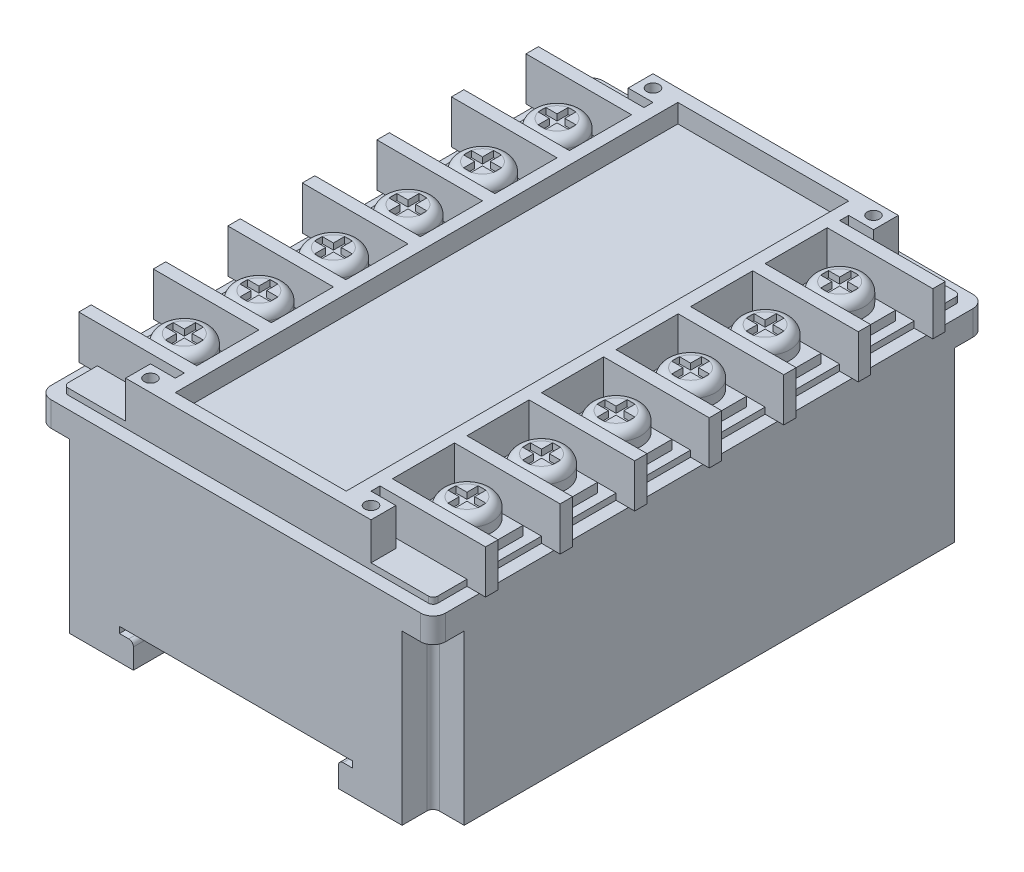
from build123d import *

# Parameters (mm, degrees)
BOSS_EXTRUDE1_DEPTH  = 44.45
SKETCH3_W            = 5
SKETCH3_H            = 5
CUT_EXTRUDE1_DEPTH   = 27.1
FILLET1_R            = 1
FILLET2_R            = 2
SKETCH4_W            = 69.628176227
SKETCH4_H            = 95.221235597
CUT_EXTRUDE2_DEPTH   = 1
SKETCH5_R            = 1
BOSS_EXTRUDE2_DEPTH  = 6
BOSS_EXTRUDE3_START  = -1
SKETCH7_W            = 17
SKETCH7_H            = 2
BOSS_EXTRUDE3_DEPTH  = 7
SKETCH8_W            = 27.5
SKETCH8_H            = 80.9
CUT_EXTRUDE3_DEPTH   = 3
SKETCH9_W            = 11
SKETCH9_H            = 7
BOSS_EXTRUDE4_DEPTH  = 1.5
CUT_EXTRUDE4_DEPTH   = 1
LPATTERN1_COUNT      = 6
LPATTERN1_PITCH      = 12
LPATTERN1_COUNT_DIR2 = 2
LPATTERN1_PITCH_DIR2 = 45.5


with BuildPart() as part:
    # Sketch2 → Boss-Extrude1 (new, symmetric)
    with BuildSketch(Plane.XY):
        with BuildLine():
            Line((0, 0), (1.5, 0))
            ThreePointArc((1.5, 0), (2.030330086, -0.219669914), (2.25, -0.75))
            Line((2.25, -0.75), (2.25, -4))
            Line((2.25, -4), (-13, -4))
            Line((-13, -4), (-13, 28.1))
            Line((-13, 28.1), (50.5, 28.1))
            Line((50.5, 28.1), (50.5, -4))
            Line((50.5, -4), (35.25, -4))
            Line((35.25, -4), (35.25, -0.75))
            ThreePointArc((35.25, -0.75), (35.469669914, -0.219669914), (36, 0))
            Line((36, 0), (37.5, 0))
            Line((37.5, 0), (37.5, 1))
            Line((37.5, 1), (0, 1))
            Line((0, 1), (0, 0))
        make_face()
    extrude(amount=BOSS_EXTRUDE1_DEPTH, both=True)

    # Sketch3 → Cut-Extrude1 (cut)
    with BuildSketch(Plane.XZ.offset(4)):
        with Locations((-10.5, 41.95)):
            Rectangle(SKETCH3_W, SKETCH3_H)
        with Locations((48, 41.95)):
            Rectangle(SKETCH3_W, SKETCH3_H)
        with Locations((-10.5, -41.95)):
            Rectangle(SKETCH3_W, SKETCH3_H)
        with Locations((48, -41.95)):
            Rectangle(SKETCH3_W, SKETCH3_H)
    extrude(amount=-CUT_EXTRUDE1_DEPTH, mode=Mode.SUBTRACT)

    # Fillet1
    fillet1_edges = [part.edges().sort_by_distance(p)[0] for p in [
        (-8, 9.55, 39.45),
        (45.5, 9.55, 39.45),
        (-8, 9.55, -39.45),
        (45.5, 9.55, -39.45),
    ]]
    fillet(fillet1_edges, radius=FILLET1_R)

    # Fillet2
    fillet2_edges = [part.edges().sort_by_distance(p)[0] for p in [
        (-13, 25.6, -44.45),
        (-13, 25.6, 44.45),
        (50.5, 25.6, 44.45),
        (50.5, 25.6, -44.45),
    ]]
    fillet(fillet2_edges, radius=FILLET2_R)

    # Sketch4 → Cut-Extrude2 (cut)
    with BuildSketch(Plane(origin=(0, 28.1, 0), x_dir=(1, 0, 0), z_dir=(0, 1, 0))):
        with Locations((18.746661878, -0.256955383)):
            Rectangle(SKETCH4_W, SKETCH4_H)
        with BuildLine():
            Line((-10.25, -42.45), (47.75, -42.45))
            ThreePointArc((47.75, -42.45), (48.280330086, -42.230330086), (48.5, -41.7))
            Line((48.5, -41.7), (48.5, 41.7))
            ThreePointArc((48.5, 41.7), (48.280330086, 42.230330086), (47.75, 42.45))
            Line((47.75, 42.45), (-10.25, 42.45))
            ThreePointArc((-10.25, 42.45), (-10.780330086, 42.230330086), (-11, 41.7))
            Line((-11, 41.7), (-11, -41.7))
            ThreePointArc((-11, -41.7), (-10.780330086, -42.230330086), (-10.25, -42.45))
        make_face(mode=Mode.SUBTRACT)
    extrude(amount=-CUT_EXTRUDE2_DEPTH, mode=Mode.SUBTRACT)

    # Sketch5 → Boss-Extrude2 (add)
    with BuildSketch(Plane(origin=(0, 28.1, 0), x_dir=(1, 0, 0), z_dir=(0, 1, 0))):
        Polygon((3, 42.45), (34.5, 42.45), (38.5, 42.45), (38.5, 38.45), (34.5, 38.45), (34.5, -38.45), (38.5, -38.45), (38.5, -42.45), (34.5, -42.45), (3, -42.45), (-1, -42.45), (-1, -38.45), (3, -38.45), (3, 38.45), (-1, 38.45), (-1, 42.45), align=None)
        with Locations(Location((1, 40.45, 0), (0, 0, 270))):
            Circle(SKETCH5_R, mode=Mode.SUBTRACT)
        with Locations(Location((36.5, 40.45, 0), (0, 0, 270))):
            Circle(SKETCH5_R, mode=Mode.SUBTRACT)
        with Locations(Location((36.5, -40.45, 0), (0, 0, 270))):
            Circle(SKETCH5_R, mode=Mode.SUBTRACT)
        with Locations(Location((1, -40.45, 0), (0, 0, 270))):
            Circle(SKETCH5_R, mode=Mode.SUBTRACT)
    extrude(amount=BOSS_EXTRUDE2_DEPTH)

    # Sketch7 → Boss-Extrude3 (add)
    with BuildSketch(Plane(origin=(0, 28.1, 0), x_dir=(1, 0, 0), z_dir=(0, 1, 0)).offset(BOSS_EXTRUDE3_START)):
        with Locations((43, 0)):
            Rectangle(SKETCH7_W, SKETCH7_H)
        with Locations((43, 12)):
            Rectangle(SKETCH7_W, SKETCH7_H)
        with Locations((43, 24)):
            Rectangle(SKETCH7_W, SKETCH7_H)
        with Locations((43, 36)):
            Rectangle(SKETCH7_W, SKETCH7_H)
        with Locations((43, -12)):
            Rectangle(SKETCH7_W, SKETCH7_H)
        with Locations((43, -24)):
            Rectangle(SKETCH7_W, SKETCH7_H)
        with Locations((43, -36)):
            Rectangle(SKETCH7_W, SKETCH7_H)
    boss_extrude3 = extrude(amount=BOSS_EXTRUDE3_DEPTH)

    # Mirror1: Boss-Extrude3 across plane
    add(boss_extrude3.mirror(Plane(origin=(18.75, 0, 0), x_dir=(0, 0, 1), z_dir=(1, 0, 0))))

    # Sketch8 → Cut-Extrude3 (cut)
    with BuildSketch(Plane(origin=(0, 34.1, 0), x_dir=(1, 0, 0), z_dir=(0, 1, 0))):
        with Locations((18.75, 0)):
            Rectangle(SKETCH8_W, SKETCH8_H)
    extrude(amount=-CUT_EXTRUDE3_DEPTH, mode=Mode.SUBTRACT)

    # Sketch9 → Boss-Extrude4 (add)
    with BuildSketch(Plane(origin=(0, 28.1, 0), x_dir=(1, 0, 0), z_dir=(0, 1, 0))):
        with Locations((-4, -30)):
            Rectangle(SKETCH9_W, SKETCH9_H)
    boss_extrude4 = extrude(amount=BOSS_EXTRUDE4_DEPTH)

    # Sketch10 → Revolve1 (revolve)
    with BuildSketch(Plane.XY.offset(30), mode=Mode.PRIVATE) as revolve1_sk:
        with BuildLine():
            Line((-4, 32.6), (-4, 29.6))
            Line((-4, 29.6), (0, 29.6))
            Line((0, 29.6), (0, 31.1))
            ThreePointArc((0, 31.1), (-0.439339828, 32.160660172), (-1.5, 32.6))
            Line((-1.5, 32.6), (-4, 32.6))
        make_face()
    revolve1 = revolve(revolve1_sk.sketch.rotate(Axis((-4, 32.6, 30), (0, -1, 0)), 90), axis=Axis((-4, 32.6, 30), (0, -1, 0)))

    # Sketch12 → Cut-Extrude4 (cut)
    with BuildSketch(Plane(origin=(0, 32.6, 0), x_dir=(1, 0, 0), z_dir=(0, 1, 0))):
        Polygon((-3.375, -29.375), (-1.579385409, -29.375), (-1.579385409, -30.625), (-3.375, -30.625), (-3.375, -32.420614591), (-4.625, -32.420614591), (-4.625, -30.625), (-6.420614591, -30.625), (-6.420614591, -29.375), (-4.625, -29.375), (-4.625, -27.579385409), (-3.375, -27.579385409), align=None)
    cut_extrude4 = extrude(amount=-CUT_EXTRUDE4_DEPTH, mode=Mode.SUBTRACT)

    # LPattern1: Boss-Extrude4, Revolve1, Cut-Extrude4 6 × 2
    with Locations(*[(j * LPATTERN1_PITCH_DIR2, 0, -i * LPATTERN1_PITCH) for i in range(LPATTERN1_COUNT) for j in range(LPATTERN1_COUNT_DIR2) if (i, j) != (0, 0)]):
        add(boss_extrude4)
        add(revolve1)
        add(cut_extrude4, mode=Mode.SUBTRACT)


solid = part.part
